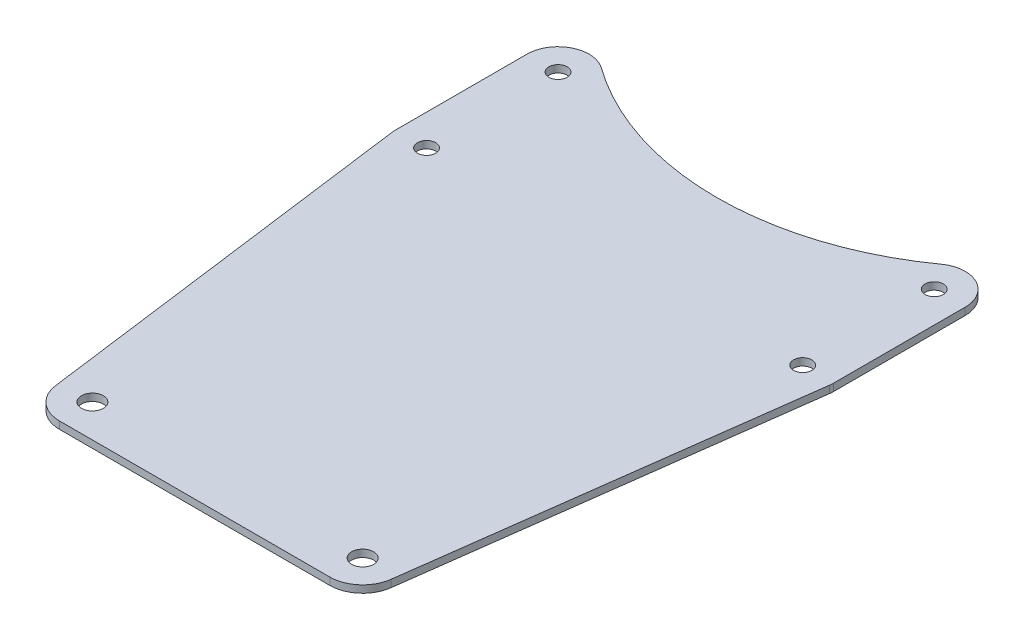
from build123d import *

# Parameters (mm, degrees)
SKICA1_R                = 1.25
SKICA1_R_2              = 1.5
P_IDAT_VYSUNUT_M1_DEPTH = 0.5


with BuildPart() as part:
    # Skica1 → Přidat vysunutím1 (new, symmetric)
    with BuildSketch(Plane(origin=(0, 0, 0), x_dir=(1, 0, 0), z_dir=(0, 1, 0))):
        with BuildLine():
            Line((-29.963432056, -9.556318536), (-22.961281, -62.589043156))
            ThreePointArc((-22.961281, -62.589043156), (-21.466420891, -65.383836152), (-18.5, -66.5))
            Line((-18.5, -66.5), (18.5, -66.5))
            ThreePointArc((18.5, -66.5), (21.466420891, -65.383836152), (22.961281, -62.589043156))
            Line((22.961281, -62.589043156), (29.963432056, -9.556318536))
            ThreePointArc((29.963432056, -9.556318536), (29.99084816, -9.278759542), (30, -9))
            Line((30, -9), (30, 9))
            ThreePointArc((30, 9), (27.693135825, 12.77977819), (23.276836158, 12.4562929))
            ThreePointArc((23.276836158, 12.4562929), (0, 4.986108431), (-23.276836158, 12.4562929))
            ThreePointArc((-23.276836158, 12.4562929), (-27.693135825, 12.77977819), (-30, 9))
            Line((-30, 9), (-30, -9))
            ThreePointArc((-30, -9), (-29.99084816, -9.278759542), (-29.963432056, -9.556318536))
        make_face()
        with Locations(Location((-25.75, 9, 0), (0, 0, 270))):
            Circle(SKICA1_R, mode=Mode.SUBTRACT)
        with Locations(Location((25.75, 9, 0), (0, 0, 270))):
            Circle(SKICA1_R, mode=Mode.SUBTRACT)
        with Locations(Location((-25.75, -9, 0), (0, 0, 270))):
            Circle(SKICA1_R, mode=Mode.SUBTRACT)
        with Locations(Location((25.75, -9, 0), (0, 0, 270))):
            Circle(SKICA1_R, mode=Mode.SUBTRACT)
        with Locations(Location((-18.5, -62, 0), (0, 0, 270))):
            Circle(SKICA1_R_2, mode=Mode.SUBTRACT)
        with Locations(Location((18.5, -62, 0), (0, 0, 270))):
            Circle(SKICA1_R_2, mode=Mode.SUBTRACT)
    extrude(amount=P_IDAT_VYSUNUT_M1_DEPTH, both=True)


solid = part.part
